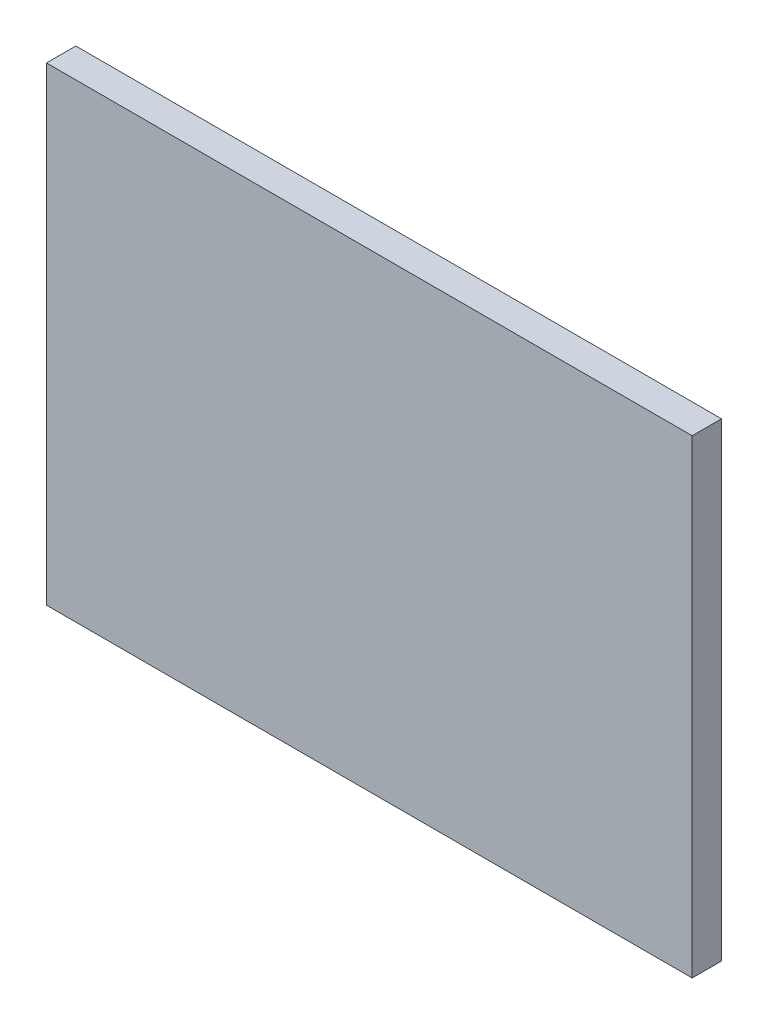
from build123d import *

# Parameters (mm, degrees)
SKETCH1_W           = 139.7
SKETCH1_H           = 101.6
BOSS_EXTRUDE1_DEPTH = 6.35


with BuildPart() as part:
    # Sketch1 → Boss-Extrude1 (new body)
    with BuildSketch(Plane.XY):
        Rectangle(SKETCH1_W, SKETCH1_H)
    extrude(amount=BOSS_EXTRUDE1_DEPTH)


solid = part.part
